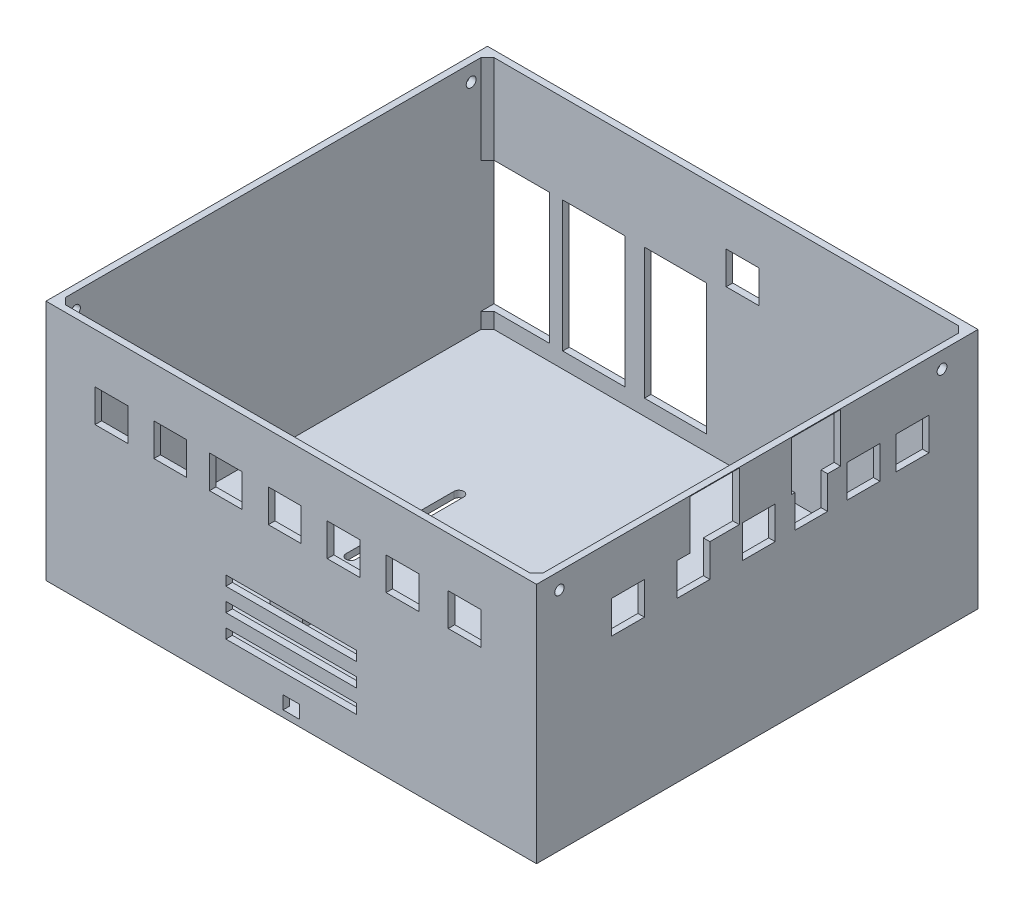
from build123d import *

# Parameters (mm, degrees)
CROQUIS1_W              = 150
CROQUIS1_H              = 135
SALIENTE_EXTRUIR1_DEPTH = 2
CORTAR_EXTRUIR2_DEPTH   = 2
CROQUIS4_W              = 150
CROQUIS4_H              = 135
CROQUIS4_W_2            = 146
CROQUIS4_H_2            = 131
SALIENTE_EXTRUIR3_DEPTH = 72
CROQUIS5_R              = 1.5
CORTAR_EXTRUIR3_DEPTH   = 2
CROQUIS6_R              = 1.5
CORTAR_EXTRUIR4_DEPTH   = 2
CROQUIS7_R              = 1.5
CORTAR_EXTRUIR5_DEPTH   = 2
CROQUIS8_R              = 1.43177866
CORTAR_EXTRUIR6_DEPTH   = 2
CROQUIS9_W              = 10
CROQUIS9_H              = 10
CORTAR_EXTRUIR7_DEPTH   = 2
CROQUIS10_W             = 10
CROQUIS10_H             = 10
CORTAR_EXTRUIR8_DEPTH   = 2
CROQUIS11_W             = 10
CROQUIS11_H             = 10
CROQUIS11_W_2           = 19
CROQUIS11_H_2           = 40
CORTAR_EXTRUIR9_DEPTH   = 2
CROQUIS13_R             = 2
CORTAR_EXTRUIR11_DEPTH  = 2
CROQUIS14_W             = 10
CROQUIS14_H             = 10
CROQUIS14_R             = 2
SALIENTE_EXTRUIR4_DEPTH = 5
CROQUIS15_W             = 5
CROQUIS15_H             = 4
CROQUIS15_W_2           = 40
CROQUIS15_H_2           = 3
CORTAR_EXTRUIR12_DEPTH  = 2
CROQUIS12_W             = 15
CROQUIS12_H             = 15
CORTAR_EXTRUIR13_DEPTH  = 2
SALIENTE_EXTRUIR5_DEPTH = 74
SALIENTE_EXTRUIR6_DEPTH = 27.2
SALIENTE_EXTRUIR7_REACH = 123.232


with BuildPart() as part:
    # Croquis1 → Saliente-Extruir1 (new body)
    with BuildSketch(Plane(origin=(0, 0, 0), x_dir=(1, 0, 0), z_dir=(0, 1, 0))):
        Rectangle(CROQUIS1_W, CROQUIS1_H)
    extrude(amount=SALIENTE_EXTRUIR1_DEPTH)

    # Croquis2 → Cortar-Extruir2 (cut)
    with BuildSketch(Plane(origin=(0, 2, 0), x_dir=(1, 0, 0), z_dir=(0, 1, 0))):
        with BuildLine():
            Line((31.25, 16.5), (31.25, 1.5))
            Line((31.25, 1.5), (16.25, 1.5))
            ThreePointArc((16.25, 1.5), (14.75, 0), (16.25, -1.5))
            Line((16.25, -1.5), (31.25, -1.5))
            Line((31.25, -1.5), (31.25, -16.5))
            ThreePointArc((31.25, -16.5), (32.75, -18), (34.25, -16.5))
            Line((34.25, -16.5), (34.25, -1.5))
            Line((34.25, -1.5), (49.25, -1.5))
            ThreePointArc((49.25, -1.5), (50.75, 0), (49.25, 1.5))
            Line((49.25, 1.5), (34.25, 1.5))
            Line((34.25, 1.5), (34.25, 16.5))
            ThreePointArc((34.25, 16.5), (32.75, 18), (31.25, 16.5))
        make_face()
        with BuildLine():
            Line((-31.25, -16.5), (-31.25, -1.5))
            Line((-31.25, -1.5), (-16.25, -1.5))
            ThreePointArc((-16.25, -1.5), (-14.75, 0), (-16.25, 1.5))
            Line((-16.25, 1.5), (-31.25, 1.5))
            Line((-31.25, 1.5), (-31.25, 16.5))
            ThreePointArc((-31.25, 16.5), (-32.75, 18), (-34.25, 16.5))
            Line((-34.25, 16.5), (-34.25, 1.5))
            Line((-34.25, 1.5), (-49.25, 1.5))
            ThreePointArc((-49.25, 1.5), (-50.75, 0), (-49.25, -1.5))
            Line((-49.25, -1.5), (-34.25, -1.5))
            Line((-34.25, -1.5), (-34.25, -16.5))
            ThreePointArc((-34.25, -16.5), (-32.75, -18), (-31.25, -16.5))
        make_face()
    extrude(amount=-CORTAR_EXTRUIR2_DEPTH, mode=Mode.SUBTRACT)

    # Croquis4 → Saliente-Extruir3 (add)
    with BuildSketch(Plane(origin=(0, 2, 0), x_dir=(1, 0, 0), z_dir=(0, 1, 0))):
        Rectangle(CROQUIS4_W, CROQUIS4_H)
        Rectangle(CROQUIS4_W_2, CROQUIS4_H_2, mode=Mode.SUBTRACT)
    extrude(amount=SALIENTE_EXTRUIR3_DEPTH)

    # Croquis5 → Cortar-Extruir3 (cut)
    with BuildSketch(Plane.ZY.offset(75)):
        with Locations((-60.5, 69)):
            Circle(CROQUIS5_R)
    extrude(amount=-CORTAR_EXTRUIR3_DEPTH, mode=Mode.SUBTRACT)

    # Croquis6 → Cortar-Extruir4 (cut)
    with BuildSketch(Plane.ZY.offset(75)):
        with Locations((60.5, 69)):
            Circle(CROQUIS6_R)
    extrude(amount=-CORTAR_EXTRUIR4_DEPTH, mode=Mode.SUBTRACT)

    # Croquis7 → Cortar-Extruir5 (cut)
    with BuildSketch(Plane(origin=(75, 0, 0), x_dir=(0, 0, -1), z_dir=(1, 0, 0))):
        with Locations((56.5, 69)):
            Circle(CROQUIS7_R)
    extrude(amount=-CORTAR_EXTRUIR5_DEPTH, mode=Mode.SUBTRACT)

    # Croquis8 → Cortar-Extruir6 (cut)
    with BuildSketch(Plane(origin=(75, 0, 0), x_dir=(0, 0, -1), z_dir=(1, 0, 0))):
        with Locations((-60.5, 69)):
            Circle(CROQUIS8_R)
    extrude(amount=-CORTAR_EXTRUIR6_DEPTH, mode=Mode.SUBTRACT)

    # Croquis9 → Cortar-Extruir7 (cut)
    with BuildSketch(Plane.XY.offset(67.5)):
        with Locations((-2, 53.8)):
            Rectangle(CROQUIS9_W, CROQUIS9_H)
        with Locations((-55, 53.8)):
            Rectangle(CROQUIS9_W, CROQUIS9_H)
        with Locations((-37, 53.8)):
            Rectangle(CROQUIS9_W, CROQUIS9_H)
        with Locations((-20, 53.8)):
            Rectangle(CROQUIS9_W, CROQUIS9_H)
        with Locations((16, 53.8)):
            Rectangle(CROQUIS9_W, CROQUIS9_H)
        with Locations((34, 53.8)):
            Rectangle(CROQUIS9_W, CROQUIS9_H)
        with Locations((53, 53.8)):
            Rectangle(CROQUIS9_W, CROQUIS9_H)
    extrude(amount=-CORTAR_EXTRUIR7_DEPTH, mode=Mode.SUBTRACT)

    # Croquis10 → Cortar-Extruir8 (cut)
    with BuildSketch(Plane(origin=(75, 0, 0), x_dir=(0, 0, -1), z_dir=(1, 0, 0))):
        with Locations((16.5, 53.8)):
            Rectangle(CROQUIS10_W, CROQUIS10_H)
        with Locations((-39.5, 53.8)):
            Rectangle(CROQUIS10_W, CROQUIS10_H)
        with Locations((-19.5, 53.8)):
            Rectangle(CROQUIS10_W, CROQUIS10_H)
        with Locations((0.5, 53.8)):
            Rectangle(CROQUIS10_W, CROQUIS10_H)
        with Locations((32.5, 53.8)):
            Rectangle(CROQUIS10_W, CROQUIS10_H)
        with Locations((47.5, 53.8)):
            Rectangle(CROQUIS10_W, CROQUIS10_H)
    extrude(amount=-CORTAR_EXTRUIR8_DEPTH, mode=Mode.SUBTRACT)

    # Croquis11 → Cortar-Extruir9 (cut)
    with BuildSketch(Plane(origin=(0, 0, -67.5), x_dir=(-1, 0, 0), z_dir=(0, 0, -1))):
        with Locations((-5, 53.8)):
            Rectangle(CROQUIS11_W, CROQUIS11_H)
        with Locations((15.5, 26.8)):
            Rectangle(CROQUIS11_W_2, CROQUIS11_H_2)
        with Locations((40.5, 26.8)):
            Rectangle(CROQUIS11_W_2, CROQUIS11_H_2)
        with Locations((63.5, 26.8)):
            Rectangle(CROQUIS11_W_2, CROQUIS11_H_2)
    extrude(amount=-CORTAR_EXTRUIR9_DEPTH, mode=Mode.SUBTRACT)

    # Croquis13 → Cortar-Extruir11 (cut)
    with BuildSketch(Plane.XZ):
        with Locations(Location((-26, 38, 0), (0, 0, 270))):
            Circle(CROQUIS13_R)
        with Locations(Location((26, 38, 0), (0, 0, 90))):
            Circle(CROQUIS13_R)
    extrude(amount=-CORTAR_EXTRUIR11_DEPTH, mode=Mode.SUBTRACT)

    # Croquis14 → Saliente-Extruir4 (add)
    # profile 1 of 2: a face of its own
    with BuildSketch(Plane(origin=(0, 2, 0), x_dir=(1, 0, 0), z_dir=(0, 1, 0))):
        with Locations((26, -38)):
            Rectangle(CROQUIS14_W, CROQUIS14_H)
        with Locations(Location((26, -38, 0), (0, 0, 270))):
            Circle(CROQUIS14_R, mode=Mode.SUBTRACT)
    # profile 2 of 2: a face of its own
    with BuildSketch(Plane(origin=(0, 2, 0), x_dir=(1, 0, 0), z_dir=(0, 1, 0))):
        with Locations((-26, -38)):
            Rectangle(CROQUIS14_W, CROQUIS14_H)
        with Locations(Location((-26, -38, 0), (0, 0, 90))):
            Circle(CROQUIS14_R, mode=Mode.SUBTRACT)
    extrude(amount=SALIENTE_EXTRUIR4_DEPTH)

    # Croquis15 → Cortar-Extruir12 (cut)
    with BuildSketch(Plane.XY.offset(67.5)):
        with Locations((0, 4)):
            Rectangle(CROQUIS15_W, CROQUIS15_H)
        with Locations((0, 13.5)):
            Rectangle(CROQUIS15_W_2, CROQUIS15_H_2)
        with Locations((0, 20.5)):
            Rectangle(CROQUIS15_W_2, CROQUIS15_H_2)
        with Locations((0, 27.5)):
            Rectangle(CROQUIS15_W_2, CROQUIS15_H_2)
    extrude(amount=-CORTAR_EXTRUIR12_DEPTH, mode=Mode.SUBTRACT)

    # Croquis12 → Cortar-Extruir13 (cut)
    with BuildSketch(Plane(origin=(75, 0, 0), x_dir=(0, 0, -1), z_dir=(1, 0, 0))):
        with Locations((18, 66.3)):
            Rectangle(CROQUIS12_W, CROQUIS12_H)
        with Locations((-13, 66.3)):
            Rectangle(CROQUIS12_W, CROQUIS12_H)
    extrude(amount=-CORTAR_EXTRUIR13_DEPTH, mode=Mode.SUBTRACT)

    # Croquis16 → Saliente-Extruir5 (add)
    with BuildSketch(Plane(origin=(0, 74, 0), x_dir=(1, 0, 0), z_dir=(0, 1, 0))):
        Polygon((-73, -65.5), (-73, -63.5), (-71, -65.5), align=None)
        Polygon((73, -65.5), (71, -65.5), (73, -63.5), align=None)
        Polygon((73, 65.5), (73, 63.5), (71, 65.5), align=None)
    extrude(amount=-SALIENTE_EXTRUIR5_DEPTH)

    # Croquis17 → Saliente-Extruir6 (add)
    with BuildSketch(Plane(origin=(0, 74, 0), x_dir=(1, 0, 0), z_dir=(0, 1, 0))):
        Polygon((-73, 65.5), (-73, 63.5), (-71, 65.5), align=None)
    extrude(amount=-SALIENTE_EXTRUIR6_DEPTH)

    # Croquis18 → Saliente-Extruir7 (add, up to next)
    with BuildSketch(Plane(origin=(0, 6.8, 0), x_dir=(1, 0, 0), z_dir=(0, 1, 0)), mode=Mode.PRIVATE) as saliente_extruir7_sk1:
        Polygon((-73, 65.5), (-71, 65.5), (-73, 63.5), align=None)
    saliente_extruir7_tool1 = extrude(saliente_extruir7_sk1.sketch, amount=-SALIENTE_EXTRUIR7_REACH, mode=Mode.PRIVATE) - part.part
    add(saliente_extruir7_tool1.solids().sort_by_distance((-72.333333, 6.8, -64.833333))[0])


solid = part.part
